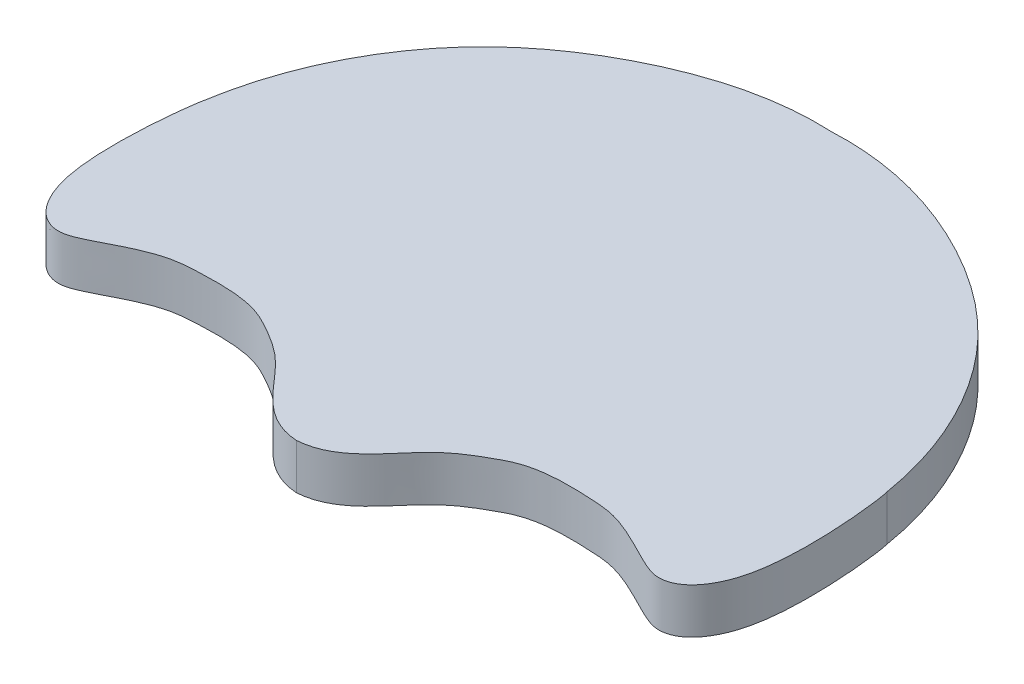
from build123d import *

# Parameters (mm, degrees)
BOSS_EXTRUDE1_DEPTH = 25.4


with BuildPart() as part:
    # Sketch3 → Boss-Extrude1 (new body)
    with BuildSketch(Plane(origin=(0, 0, 0), x_dir=(1, 0, 0), z_dir=(0, 1, 0))):
        with BuildLine():
            add(Edge.make_bspline(
                [(-190.5, 0), (-184.392726562, 37.537038237), (-157.261289847, 93.964093485), (-82.387478202, 146.622658841), (-31.311374143, 160.799884185), (0, 159.189909928)],
                knots=[0, 0, 0, 0, 0.424401366, 0.656369581, 1, 1, 1, 1], degree=3))
            add(Edge.make_bspline(
                [(190.5, 0), (184.392726562, 37.537038237), (157.261289847, 93.964093485), (82.387478202, 146.622658841), (31.311374143, 160.799884185), (0, 159.189909928)],
                knots=[0, 0, 0, 0, 0.424401366, 0.656369581, 1, 1, 1, 1], degree=3))
            add(Edge.make_bspline(
                [(190.5, 0), (192.064011793, -4.963501926), (201.967167766, -83.314618311), (174.696602041, -109.289958804), (151.630121659, -100.567984898), (131.410771519, -87.719783961), (96.843567628, -85.375403377), (78.692510144, -86.25882742), (58.833533072, -96.87938247), (37.30593461, -109.935798162), (21.349613946, -139.114767457), (0, -140.530090072)],
                knots=[0, 0, 0, 0, 0.166997052, 0.292320514, 0.319633117, 0.42673531, 0.45891405, 0.609241775, 0.641909704, 0.76680237, 1, 1, 1, 1], degree=3))
            add(Edge.make_bspline(
                [(-190.5, 0), (-192.064011793, -4.963501926), (-201.967167766, -83.314618311), (-174.696602041, -109.289958804), (-151.630121659, -100.567984898), (-131.410771519, -87.719783961), (-96.843567628, -85.375403377), (-78.692510144, -86.25882742), (-58.833533072, -96.87938247), (-37.30593461, -109.935798162), (-21.349613946, -139.114767457), (0, -140.530090072)],
                knots=[0, 0, 0, 0, 0.166997052, 0.292320514, 0.319633117, 0.42673531, 0.45891405, 0.609241775, 0.641909704, 0.76680237, 1, 1, 1, 1], degree=3))
        make_face()
    extrude(amount=BOSS_EXTRUDE1_DEPTH)


solid = part.part
